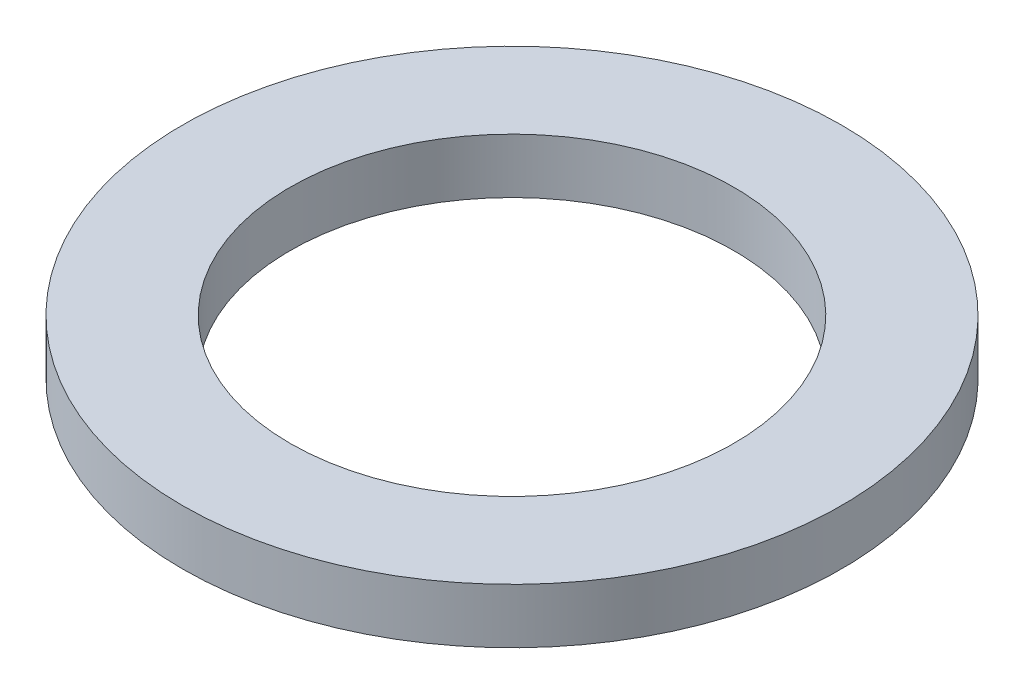
from build123d import *

# Parameters (mm, degrees)
SKETCH1_R           = 9.525
SKETCH1_R_2         = 6.4135
BOSS_EXTRUDE1_DEPTH = 1.5875


with BuildPart() as part:
    # Sketch1 → Boss-Extrude1 (new body)
    with BuildSketch(Plane(origin=(0, 0, 0), x_dir=(1, 0, 0), z_dir=(0, 1, 0))):
        with Locations(Location((0, 0, 0), (0, 0, 270))):
            Circle(SKETCH1_R)
        with Locations(Location((0, 0, 0), (0, 0, 270))):
            Circle(SKETCH1_R_2, mode=Mode.SUBTRACT)
    extrude(amount=BOSS_EXTRUDE1_DEPTH)


solid = part.part
